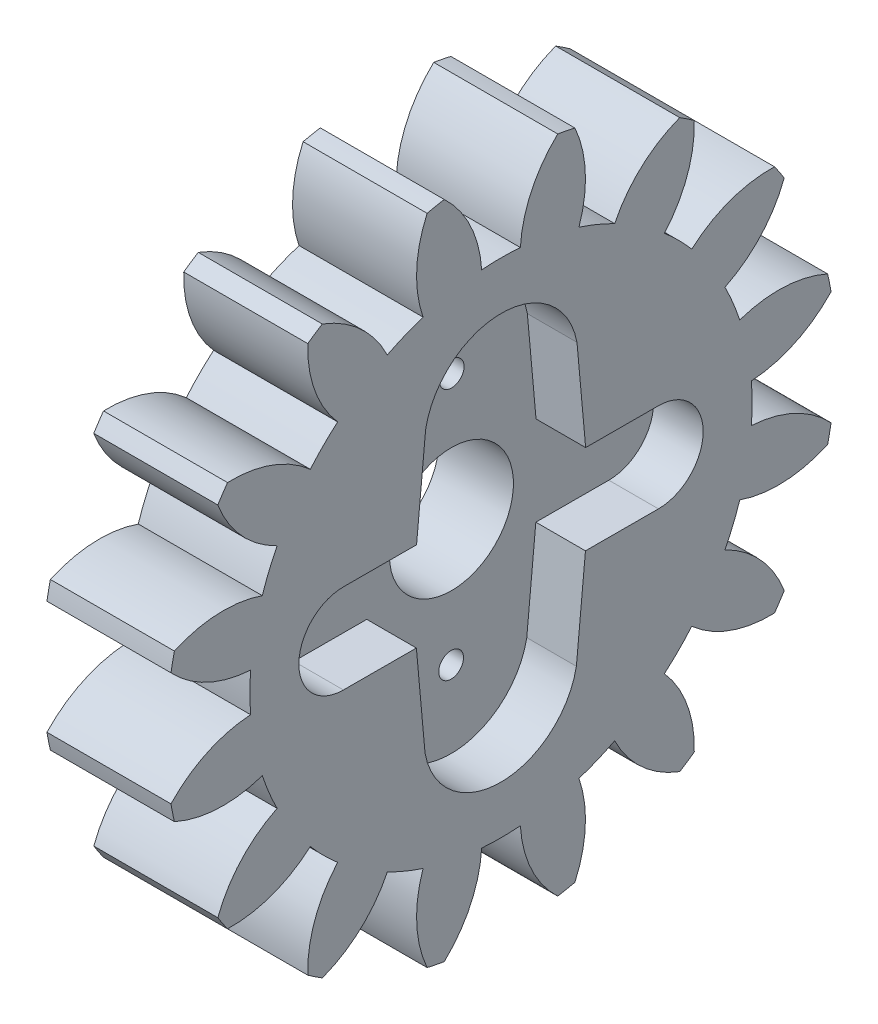
from build123d import *

# Parameters (mm, degrees)
BASPROSKE_W             = 5
BASPROSKE_H             = 13.5
TOOTHCUT_DEPTH          = 20.735754356
TEETHCUTS_COUNT         = 16
TEETHCUTS_ANGLE         = 337.5
BORSKE_R                = 2.5
BORE_DEPTH              = 50.0000508
ENL_V_MAT_EXTRU_1_DEPTH = 2
ESQUISSE2_R             = 0.5
ENL_V_MAT_EXTRU_2_DEPTH = 20.053559185


with BuildPart() as part:
    # BasProSke → Base-Revolve (revolve)
    with BuildSketch(Plane(origin=(0, 0, 0), x_dir=(1, 0, 0), z_dir=(0, 1, 0)), mode=Mode.PRIVATE) as base_revolve_sk:
        with Locations((2.5, 6.75)):
            Rectangle(BASPROSKE_W, BASPROSKE_H)
    revolve(base_revolve_sk.sketch.rotate(Axis((-10, 0, 0), (1, 0, 0)), 180), axis=Axis((-10, 0, 0), (1, 0, 0)))

    # TooCutSke → ToothCut (cut, through all)
    with BuildSketch(Plane(origin=(0, 0, 0), x_dir=(0, 0, -1), z_dir=(1, 0, 0))):
        with BuildLine():
            ThreePointArc((0.779807897, 10.093922708), (0, 10.124), (-0.779807897, 10.093922708))
            ThreePointArc((-0.779807897, 10.093922708), (-1.232785697, 11.858156262), (-2.310463203, 13.326597651))
            ThreePointArc((-2.310463203, 13.326597651), (0, 13.5254), (2.310463203, 13.326597651))
            ThreePointArc((2.310463203, 13.326597651), (1.232785697, 11.858156262), (0.779807897, 10.093922708))
        make_face()
    toothcut = extrude(amount=TOOTHCUT_DEPTH, mode=Mode.SUBTRACT)

    # TeethCuts: ToothCut ×16 about axis
    teethcuts_axis = Axis((-10, 0, 0), (1, 0, 0))
    for i in range(1, TEETHCUTS_COUNT):
        add(toothcut.rotate(teethcuts_axis, i * TEETHCUTS_ANGLE / (TEETHCUTS_COUNT - 1)), mode=Mode.SUBTRACT)

    # BorSke → Bore (cut, symmetric)
    with BuildSketch(Plane(origin=(0, 0, 0), x_dir=(0, 0, -1), z_dir=(1, 0, 0))):
        with Locations(Location((0, 0, 0), (0, 0, 180))):
            Circle(BORSKE_R)
    extrude(amount=BORE_DEPTH, both=True, mode=Mode.SUBTRACT)

    # Esquisse1 → Enlèv. mat.-Extru.1 (cut)
    with BuildSketch(Plane(origin=(5, 0, 0), x_dir=(0, 0, -1), z_dir=(1, 0, 0))):
        with BuildLine():
            Line((-6.353817175, -1.786479026), (-3.411680983, -1.792741804))
            Line((-3.411680983, -1.792741804), (-3.062404796, -5.643188497))
            ThreePointArc((-3.062404796, -5.643188497), (-0.017415965, -8.181695296), (3.038352407, -5.656174874))
            Line((3.038352407, -5.656174874), (3.404017861, -1.80725004))
            Line((3.404017861, -1.80725004), (6.346154052, -1.813512818))
            ThreePointArc((6.346154052, -1.813512818), (8.149981536, -0.017348458), (6.353817175, 1.786479026))
            Line((6.353817175, 1.786479026), (3.411680983, 1.792741804))
            Line((3.411680983, 1.792741804), (3.062404796, 5.643188497))
            ThreePointArc((3.062404796, 5.643188497), (0.017415965, 8.181695296), (-3.038352407, 5.656174874))
            Line((-3.038352407, 5.656174874), (-3.404017861, 1.80725004))
            Line((-3.404017861, 1.80725004), (-6.346154052, 1.813512818))
            ThreePointArc((-6.346154052, 1.813512818), (-8.149981536, 0.017348458), (-6.353817175, -1.786479026))
        make_face()
    extrude(amount=-ENL_V_MAT_EXTRU_1_DEPTH, mode=Mode.SUBTRACT)

    # Esquisse2 → Enlèv. mat.-Extru.2 (cut, through all)
    with BuildSketch(Plane(origin=(3, 0, 0), x_dir=(0, 0, -1), z_dir=(1, 0, 0))):
        with Locations((-0.010809829, -5.078255711)):
            Circle(ESQUISSE2_R)
        with Locations((0.010809829, 5.078255711)):
            Circle(ESQUISSE2_R)
    extrude(amount=-ENL_V_MAT_EXTRU_2_DEPTH, mode=Mode.SUBTRACT)


solid = part.part
